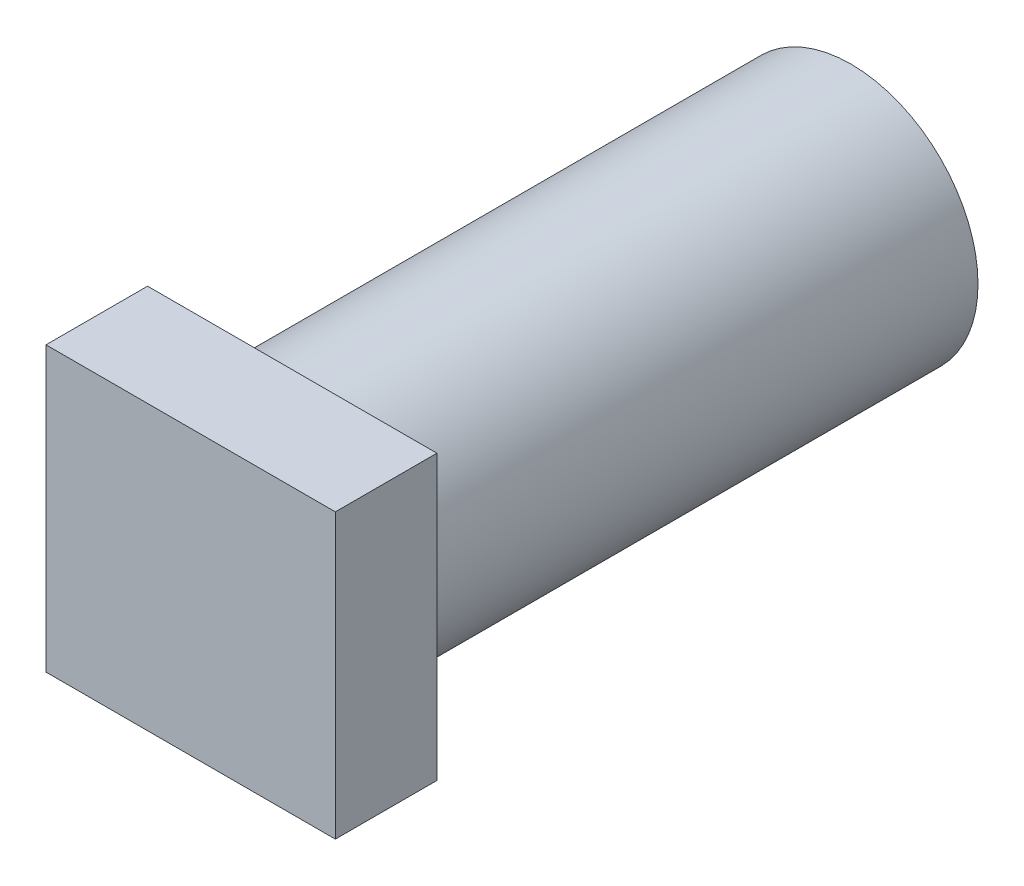
from build123d import *

# Parameters (mm, degrees)
SKETCH_1_R                   = 2.5
EXTRUDE_1_DEPTH              = 11
SKETCH_2_W                   = 5.696018396
SKETCH_2_H                   = 5.580245664
EXTRUDE_2_DEPTH              = 2
HOLE_WIZARD_M4_1_D           = 3.3
HOLE_WIZARD_M4_1_DEPTH       = 10.1
HOLE_WIZARD_M4_1_CSINK_D     = 4.05
HOLE_WIZARD_M4_1_CSINK_ANGLE = 90
HOLE_WIZARD_M4_1_TIP         = 0.991420021


with BuildPart() as part:
    # 스케치1 → 보스-돌출1 (new body)
    with BuildSketch(Plane.XY):
        Circle(SKETCH_1_R)
    extrude(amount=EXTRUDE_1_DEPTH)

    # 스케치2 → 보스-돌출2 (add)
    with BuildSketch(Plane.XY.offset(11)):
        Rectangle(SKETCH_2_W, SKETCH_2_H)
    extrude(amount=EXTRUDE_2_DEPTH)

    # M4 나사 구멍1
    with Locations(Plane(origin=(0, 0, 0), x_dir=(-1, 0, 0), z_dir=(0, 0, -1))):
        with Locations((0, 0)):
            CounterSinkHole(HOLE_WIZARD_M4_1_D / 2, HOLE_WIZARD_M4_1_CSINK_D / 2, depth=HOLE_WIZARD_M4_1_DEPTH, counter_sink_angle=HOLE_WIZARD_M4_1_CSINK_ANGLE)
            with Locations((0, 0, -(HOLE_WIZARD_M4_1_DEPTH + HOLE_WIZARD_M4_1_TIP / 2))):  # 118° drill point
                Cone(0, HOLE_WIZARD_M4_1_D / 2, HOLE_WIZARD_M4_1_TIP, mode=Mode.SUBTRACT)


solid = part.part
